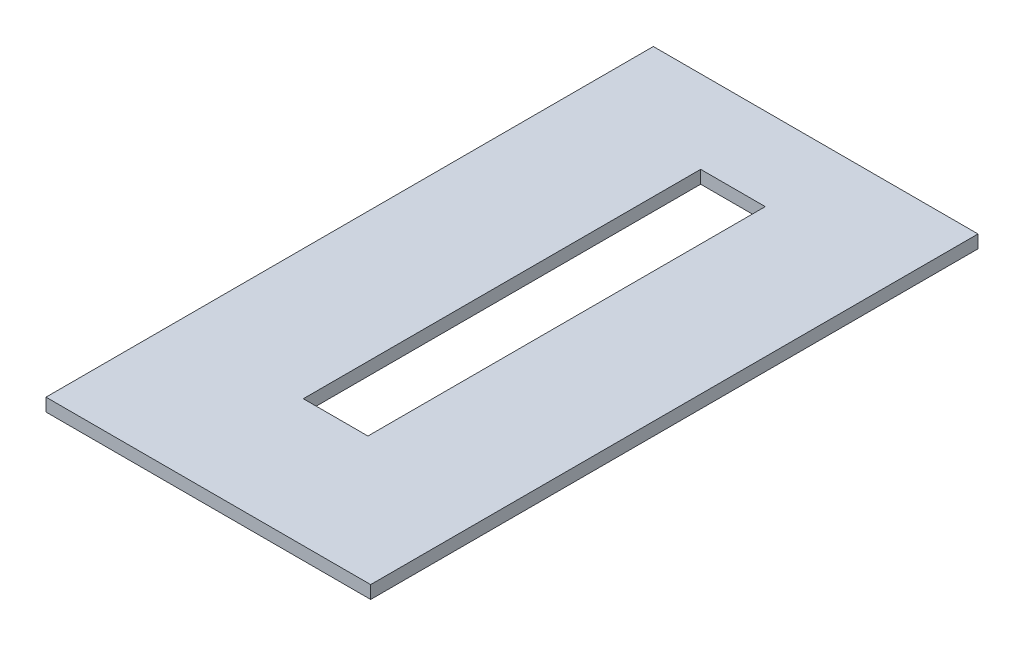
from build123d import *

# Parameters (mm, degrees)
SKETCH_1_W          = 5025
SKETCH_1_H          = 9400
EXTRUDE_1_DEPTH     = 200
SKETCH_2_W          = 1000
SKETCH_2_H          = 6150
CUT_EXTRUDE_1_DEPTH = 5334.165687469


with BuildPart() as part:
    # Эскиз1 → Бобышка-Вытянуть1 (new body)
    with BuildSketch(Plane(origin=(0, 0, 0), x_dir=(1, 0, 0), z_dir=(0, 1, 0))):
        Rectangle(SKETCH_1_W, SKETCH_1_H)
    extrude(amount=-EXTRUDE_1_DEPTH)

    # Эскиз2 → Вырез-Вытянуть1 (cut, through all)
    with BuildSketch(Plane(origin=(0, 0, 0), x_dir=(1, 0, 0), z_dir=(0, 1, 0))):
        with Locations((0, 345)):
            Rectangle(SKETCH_2_W, SKETCH_2_H)
    extrude(amount=-CUT_EXTRUDE_1_DEPTH, mode=Mode.SUBTRACT)


solid = part.part
